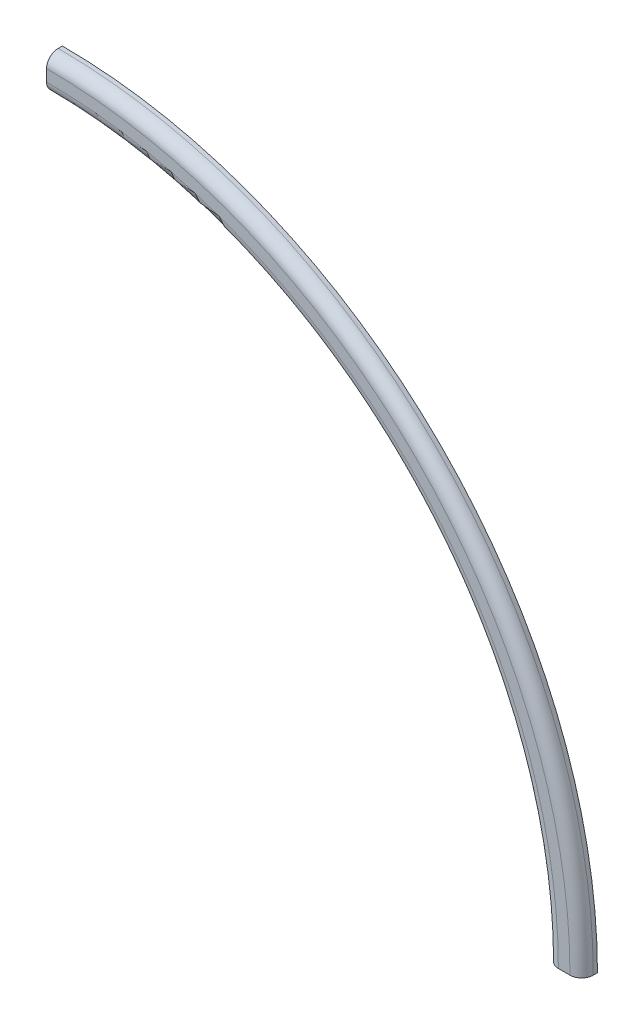
from build123d import *

# Parameters (mm, degrees)
BOSS_EXTRUDE1_DEPTH = 17.272
FILLET2_R           = 12.7


with BuildPart() as part:
    # Sketch1 → Boss-Extrude1 (new body)
    with BuildSketch(Plane.XY):
        with BuildLine():
            Line((0, 584.2), (0, 546.1))
            ThreePointArc((0, 546.1), (386.151013206, 386.151013206), (546.1, 0))
            Line((546.1, 0), (584.2, 0))
            ThreePointArc((584.2, 0), (413.091781569, 413.091781569), (0, 584.2))
        make_face()
    extrude(amount=BOSS_EXTRUDE1_DEPTH)

    # Fillet2
    fillet2_edges = [part.edges().sort_by_distance(p)[0] for p in [
        (386.151013206, 386.151013206, 17.272),
        (413.091781569, 413.091781569, 17.272),
    ]]
    fillet(fillet2_edges, radius=FILLET2_R)


solid = part.part
